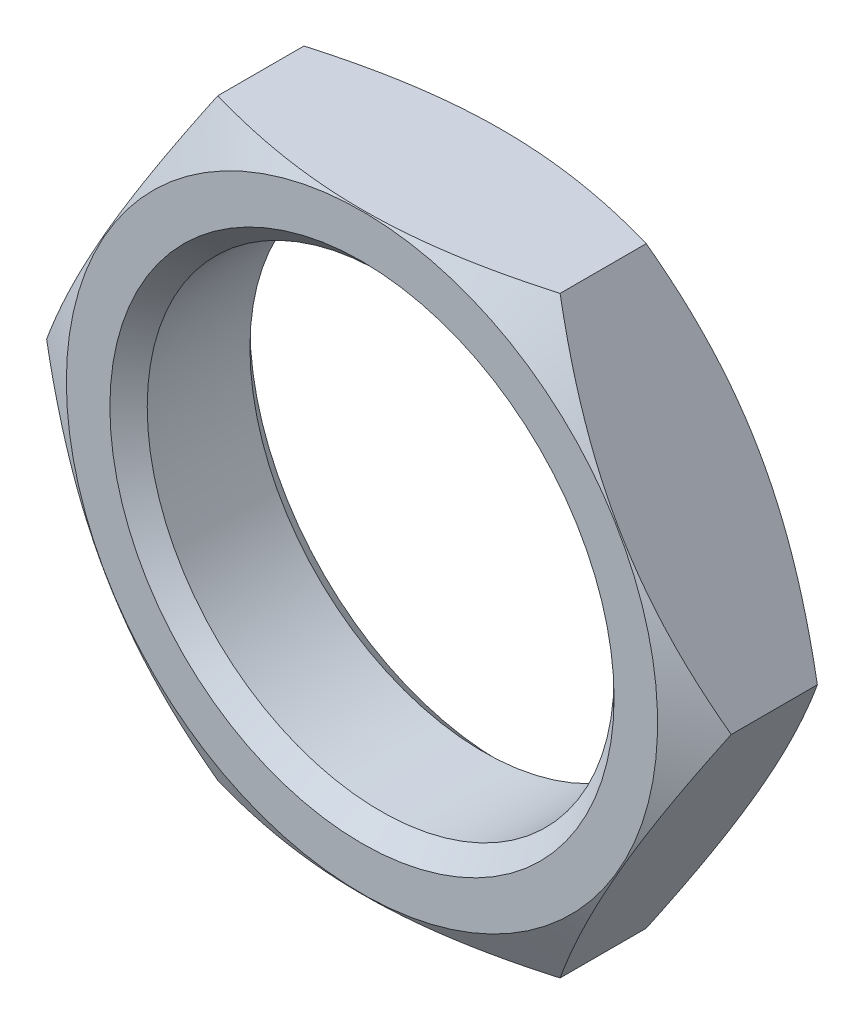
from build123d import *

# Parameters (mm, degrees)
ESQUISSE1_R        = 2.5
BOSS_EXTRU_1_DEPTH = 1.5
CHANFREIN1_SIZE    = 0.2


with BuildPart() as part:
    # Esquisse1 → Boss.-Extru.1 (new body)
    with BuildSketch(Plane.XY):
        Polygon((3.666174209, 0), (1.833087105, 3.175), (-1.833087105, 3.175), (-3.666174209, 0), (-1.833087105, -3.175), (1.833087105, -3.175), align=None)
        Circle(ESQUISSE1_R, mode=Mode.SUBTRACT)
    extrude(amount=BOSS_EXTRU_1_DEPTH)

    # Esquisse2 → Enlèvement de matière-Révolution1 (revolve, cut)
    with BuildSketch(Plane(origin=(0, 0, 0), x_dir=(1, 0, 0), z_dir=(0, 1, 0))):
        Polygon((-3.166174209, 0), (-3.666174209, -0.288675135), (-3.666174209, -1.211324865), (-3.166174209, -1.5), (-4.666174209, -1.5), (-4.666174209, 0), align=None)
    revolve(axis=Axis((0, 0, 0), (0, 0, 1)), mode=Mode.SUBTRACT)

    # Chanfrein1
    chanfrein1_edges = [part.edges().sort_by_distance(p)[0] for p in [
        (-2.5, 0, 0),
        (-2.5, 0, 1.5),
    ]]
    chamfer(chanfrein1_edges, length=CHANFREIN1_SIZE)


solid = part.part
